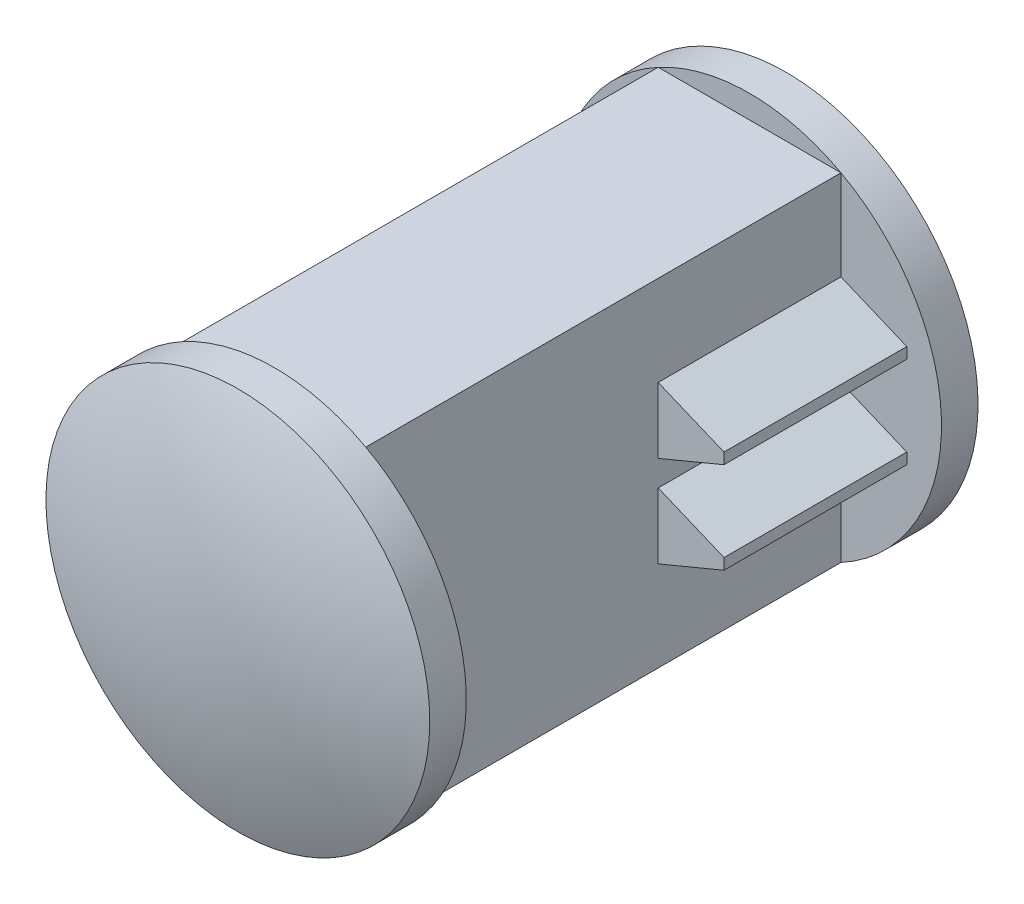
from build123d import *

# Parameters (mm, degrees)
SKETCH1_R           = 5.25
BOSS_EXTRUDE1_DEPTH = 1
DOME1_FACE_RADIUS   = 5.25
DOME1_HEIGHT        = 1
SKETCH2_W           = 5
SKETCH2_H           = 9.233092656
BOSS_EXTRUDE2_DEPTH = 13
BOSS_EXTRUDE3_START = 1
SKETCH3_R           = 5.25
BOSS_EXTRUDE3_DEPTH = 1
BOSS_EXTRUDE4_DEPTH = 5


with BuildPart() as part:
    # Sketch1 → Boss-Extrude1 (new body)
    with BuildSketch(Plane.XY):
        Circle(SKETCH1_R)
    extrude(amount=BOSS_EXTRUDE1_DEPTH)

    # Dome1: a dome of height H over a round flat face of radius A is a cap of a sphere of radius (A * A + H * H) / (2 * H)
    dome1_r = (DOME1_FACE_RADIUS * DOME1_FACE_RADIUS + DOME1_HEIGHT * DOME1_HEIGHT) / (2 * DOME1_HEIGHT)
    dome1_base = Plane((0, 0, 1), z_dir=(0, 0, 1))
    with Locations(dome1_base.offset(DOME1_HEIGHT - dome1_r)):
        dome1_ball = Sphere(dome1_r, mode=Mode.PRIVATE)
    add(split(dome1_ball, bisect_by=dome1_base, keep=Keep.TOP, mode=Mode.PRIVATE))

    # Sketch2 → Boss-Extrude2 (add)
    with BuildSketch(Plane(origin=(0, 0, 0), x_dir=(-1, 0, 0), z_dir=(0, 0, -1))):
        Rectangle(SKETCH2_W, SKETCH2_H)
    extrude(amount=BOSS_EXTRUDE2_DEPTH)

    # Sketch3 → Boss-Extrude3 (add)
    with BuildSketch(Plane(origin=(0, 0, -13), x_dir=(-1, 0, 0), z_dir=(0, 0, -1)).offset(BOSS_EXTRUDE3_START)):
        with Locations(Location((0, 0, 0), (0, 0, 61.563109851))):
            Circle(SKETCH3_R)
    extrude(amount=-BOSS_EXTRUDE3_DEPTH)

    # Sketch4 → Boss-Extrude4 (add)
    with BuildSketch(Plane.XY.offset(-13)):
        Polygon((-4.3, 1.4), (-2.5, 2.15), (-2.5, 0.35), (-4.3, 1.1), align=None)
        Polygon((-4.3, -1.1), (-4.3, -1.4), (-2.5, -2.15), (-2.5, -0.35), align=None)
        Polygon((4.3, 1.4), (2.5, 2.15), (2.5, 0.35), (4.3, 1.1), align=None)
        Polygon((4.3, -1.1), (2.5, -0.35), (2.5, -2.15), (4.3, -1.4), align=None)
    extrude(amount=BOSS_EXTRUDE4_DEPTH)


solid = part.part
